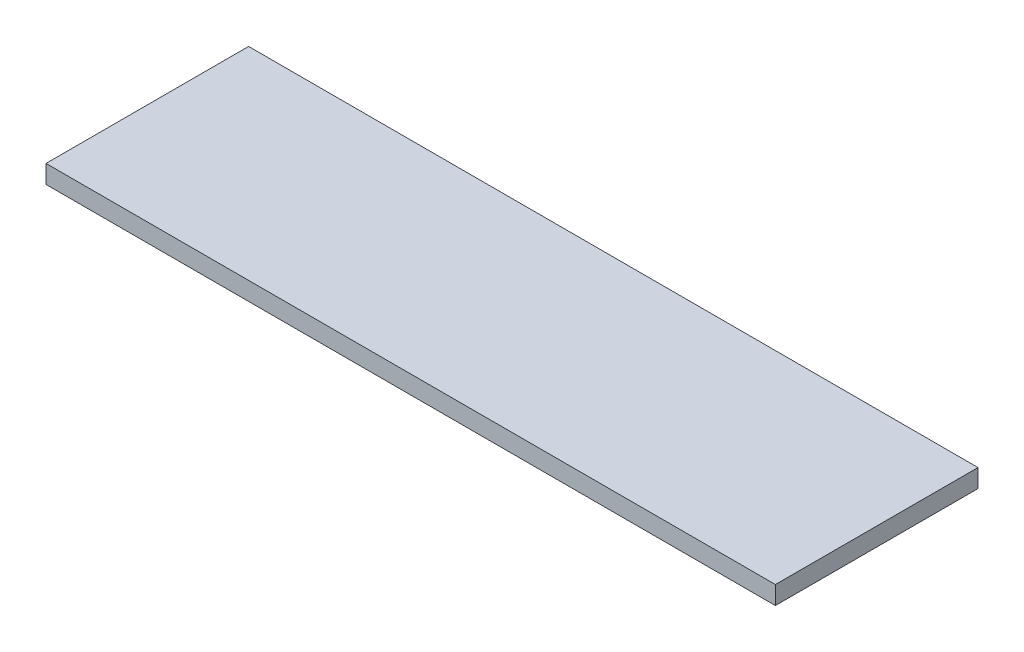
from build123d import *

# Parameters (mm, degrees)
SKETCH1_W           = 720
SKETCH1_H           = 200
BOSS_EXTRUDE1_DEPTH = 18


with BuildPart() as part:
    # Sketch1 → Boss-Extrude1 (new body)
    with BuildSketch(Plane(origin=(0, 0, 0), x_dir=(1, 0, 0), z_dir=(0, 1, 0))):
        Rectangle(SKETCH1_W, SKETCH1_H)
    extrude(amount=BOSS_EXTRUDE1_DEPTH)


solid = part.part
